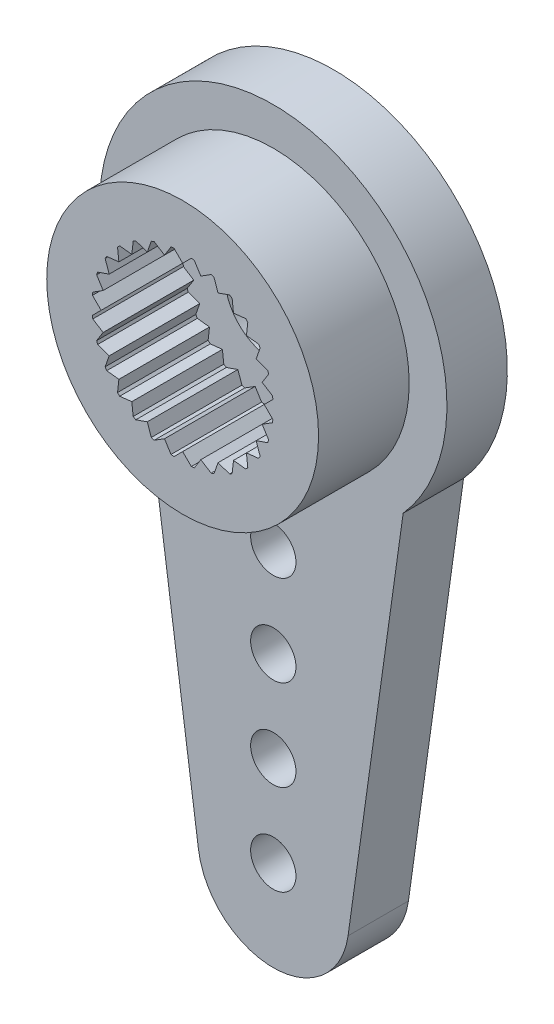
from build123d import *

# Parameters (mm, degrees)
ESQUISSE1_R                  = 5.75
ESQUISSE1_R_2                = 1.6
BOSS_EXTRU_1_DEPTH           = 5
ESQUISSE2_R                  = 3
ENL_V_MAT_EXTRU_1_DEPTH      = 3
ENL_V_START                  = -3
ESQUISSE3_R                  = 5.75
ESQUISSE3_R_2                = 4.5
ENL_V_MAT_EXTRU_2_DEPTH      = 3
BOSS_EXTRU_2_DEPTH           = 2
R_P_TITION_CIRCULAIRE1_COUNT = 2
ESQUISSE5_R                  = 0.75
ENL_V_MAT_EXTRU_3_DEPTH      = 3
R_P_TITION_CIRCULAIRE2_COUNT = 2
BOSS_EXTRU_3_DEPTH           = 3
R_P_TITION_CIRCULAIRE3_COUNT = 28
ENL_V_START_2                = -1
ESQUISSE7_R                  = 3
ESQUISSE7_R_2                = 1.6
ENL_V_MAT_EXTRU_4_DEPTH      = 1
ESQUISSE8_R                  = 4.7
ESQUISSE8_R_2                = 3.4
ENL_V_MAT_EXTRU_5_DEPTH      = 1
SKETCH1_R                    = 0.75
CUT_EXTRUDE1_DEPTH           = 10


with BuildPart() as part:
    # Esquisse1 → Boss.-Extru.1 (new body)
    with BuildSketch(Plane.XY):
        Circle(ESQUISSE1_R)
        Circle(ESQUISSE1_R_2, mode=Mode.SUBTRACT)
    extrude(amount=BOSS_EXTRU_1_DEPTH)

    # Esquisse2 → Enlèv. mat.-Extru.1 (cut)
    with BuildSketch(Plane.XY.offset(5)):
        Circle(ESQUISSE2_R)
    extrude(amount=-ENL_V_MAT_EXTRU_1_DEPTH, mode=Mode.SUBTRACT)

    # Esquisse3 → Enlèv. mat.-Extru.2 (cut)
    with BuildSketch(Plane.XY.offset(5).offset(ENL_V_START)):
        Circle(ESQUISSE3_R)
        Circle(ESQUISSE3_R_2, mode=Mode.SUBTRACT)
    extrude(amount=ENL_V_MAT_EXTRU_2_DEPTH, mode=Mode.SUBTRACT)

    # Esquisse4 → Boss.-Extru.2 (add)
    with BuildSketch(Plane(origin=(0, 0, 0), x_dir=(-1, 0, 0), z_dir=(0, 0, -1))):
        with BuildLine():
            Line((-4.3, 3.817394399), (-2.475852955, 16.846629695))
            ThreePointArc((-2.475852955, 16.846629695), (0, 19), (2.475852955, 16.846629695))
            Line((2.475852955, 16.846629695), (4.3, 3.817394399))
            ThreePointArc((4.3, 3.817394399), (0, 5.75), (-4.3, 3.817394399))
        make_face()
    boss_extru_2 = extrude(amount=-BOSS_EXTRU_2_DEPTH)

    # Répétition circulaire1: Boss.-Extru.2 ×2 about axis
    r_p_tition_circulaire1_axis = Axis((0, 0, 0), (0, 0, 1))
    for i in range(1, R_P_TITION_CIRCULAIRE1_COUNT):
        add(boss_extru_2.rotate(r_p_tition_circulaire1_axis, i * 360 / R_P_TITION_CIRCULAIRE1_COUNT))

    # Esquisse5 → Enlèv. mat.-Extru.3 (cut)
    with BuildSketch(Plane(origin=(0, 0, 0), x_dir=(-1, 0, 0), z_dir=(0, 0, -1))):
        with Locations((0, 7)):
            Circle(ESQUISSE5_R)
        with Locations((0, 10)):
            Circle(ESQUISSE5_R)
        with Locations((0, 13)):
            Circle(ESQUISSE5_R)
        with Locations((0, 16)):
            Circle(ESQUISSE5_R)
    enl_v_mat_extru_3 = extrude(amount=-ENL_V_MAT_EXTRU_3_DEPTH, mode=Mode.SUBTRACT)

    # Répétition circulaire2: Enlèv. mat.-Extru.3 ×2 about axis
    r_p_tition_circulaire2_axis = Axis((0, 0, 0), (0, 0, 1))
    for i in range(1, R_P_TITION_CIRCULAIRE2_COUNT):
        add(enl_v_mat_extru_3.rotate(r_p_tition_circulaire2_axis, i * 360 / R_P_TITION_CIRCULAIRE2_COUNT), mode=Mode.SUBTRACT)

    # Esquisse6 → Boss.-Extru.3 (add)
    with BuildSketch(Plane.XY.offset(5)):
        Polygon((-0.3, 3), (0, 2.7), (0.3, 3), align=None)
    boss_extru_3 = extrude(amount=-BOSS_EXTRU_3_DEPTH)

    # Répétition circulaire3: Boss.-Extru.3 ×28 about axis
    r_p_tition_circulaire3_axis = Axis((0, 0, 0), (0, 0, 1))
    for i in range(1, R_P_TITION_CIRCULAIRE3_COUNT):
        add(boss_extru_3.rotate(r_p_tition_circulaire3_axis, i * 360 / R_P_TITION_CIRCULAIRE3_COUNT))

    # Esquisse7 → Enlèv. mat.-Extru.4 (cut)
    with BuildSketch(Plane(origin=(0, 0, 0), x_dir=(-1, 0, 0), z_dir=(0, 0, -1)).offset(ENL_V_START_2)):
        Circle(ESQUISSE7_R)
        Circle(ESQUISSE7_R_2, mode=Mode.SUBTRACT)
    extrude(amount=ENL_V_MAT_EXTRU_4_DEPTH, mode=Mode.SUBTRACT)

    # Esquisse8 → Enlèv. mat.-Extru.5 (cut)
    with BuildSketch(Plane(origin=(0, 0, 0), x_dir=(-1, 0, 0), z_dir=(0, 0, -1))):
        Circle(ESQUISSE8_R)
        Circle(ESQUISSE8_R_2, mode=Mode.SUBTRACT)
    extrude(amount=-ENL_V_MAT_EXTRU_5_DEPTH, mode=Mode.SUBTRACT)

    # Sketch1 → Cut-Extrude1 (cut)
    with BuildSketch(Plane(origin=(0, 0, 0), x_dir=(-1, 0, 0), z_dir=(0, 0, -1))):
        with BuildLine():
            Line((-2.475852955, 16.846629695), (-4.3, 3.817394399))
            ThreePointArc((-4.3, 3.817394399), (0, 5.75), (4.3, 3.817394399))
            Line((4.3, 3.817394399), (2.475852955, 16.846629695))
            ThreePointArc((2.475852955, 16.846629695), (0, 19), (-2.475852955, 16.846629695))
        make_face()
        with Locations((0, 7)):
            Circle(SKETCH1_R, mode=Mode.SUBTRACT)
        with Locations((0, 10)):
            Circle(SKETCH1_R, mode=Mode.SUBTRACT)
        with Locations((0, 13)):
            Circle(SKETCH1_R, mode=Mode.SUBTRACT)
        with Locations((0, 16)):
            Circle(SKETCH1_R, mode=Mode.SUBTRACT)
    extrude(amount=-CUT_EXTRUDE1_DEPTH, mode=Mode.SUBTRACT)


solid = part.part
